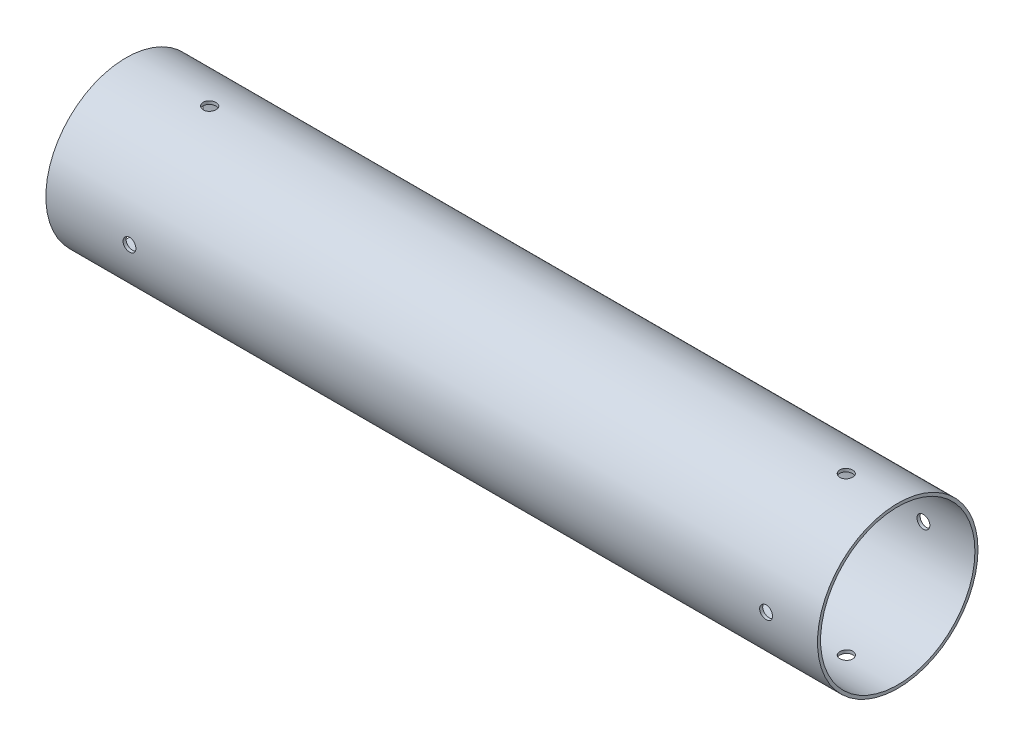
from build123d import *

# Parameters (mm, degrees)
SKETCH1_R           = 39.624
SKETCH1_R_2         = 38.1
BOSS_EXTRUDE1_DEPTH = 381
SKETCH2_R           = 3.175
CUT_EXTRUDE1_DEPTH  = 386.098848027
CIRPATTERN1_COUNT   = 4
SKETCH3_R           = 3.175
CUT_EXTRUDE2_DEPTH  = 386.098848147
CIRPATTERN2_COUNT   = 4


with BuildPart() as part:
    # Sketch1 → Boss-Extrude1 (new body)
    with BuildSketch(Plane.YZ):
        with Locations(Location((0, 0, 0), (0, 0, 270))):
            Circle(SKETCH1_R)
        with Locations(Location((0, 0, 0), (0, 0, 270))):
            Circle(SKETCH1_R_2, mode=Mode.SUBTRACT)
    extrude(amount=BOSS_EXTRUDE1_DEPTH)

    # Sketch2 → Cut-Extrude1 (cut, through all)
    with BuildSketch(Plane(origin=(0, 0, 0), x_dir=(-1, 0, 0), z_dir=(0, 1, 0))):
        with Locations(Location((-355.6, 0, 0), (0, 0, 270))):
            Circle(SKETCH2_R)
    cut_extrude1 = extrude(amount=CUT_EXTRUDE1_DEPTH, mode=Mode.SUBTRACT)

    # CirPattern1: Cut-Extrude1 ×4 about axis
    cirpattern1_axis = Axis((381, 0, 0), (-1, 0, 0))
    for i in range(1, CIRPATTERN1_COUNT):
        add(cut_extrude1.rotate(cirpattern1_axis, i * 360 / CIRPATTERN1_COUNT), mode=Mode.SUBTRACT)

    # Sketch3 → Cut-Extrude2 (cut, through all)
    with BuildSketch(Plane(origin=(0, 0, 0), x_dir=(-1, 0, 0), z_dir=(0, 1, 0))):
        with Locations(Location((-41.275, 0, 0), (0, 0, 270))):
            Circle(SKETCH3_R)
    cut_extrude2 = extrude(amount=CUT_EXTRUDE2_DEPTH, mode=Mode.SUBTRACT)

    # CirPattern2: Cut-Extrude2 ×4 about axis
    cirpattern2_axis = Axis((381, 0, 0), (-1, 0, 0))
    for i in range(1, CIRPATTERN2_COUNT):
        add(cut_extrude2.rotate(cirpattern2_axis, i * 360 / CIRPATTERN2_COUNT), mode=Mode.SUBTRACT)


solid = part.part
